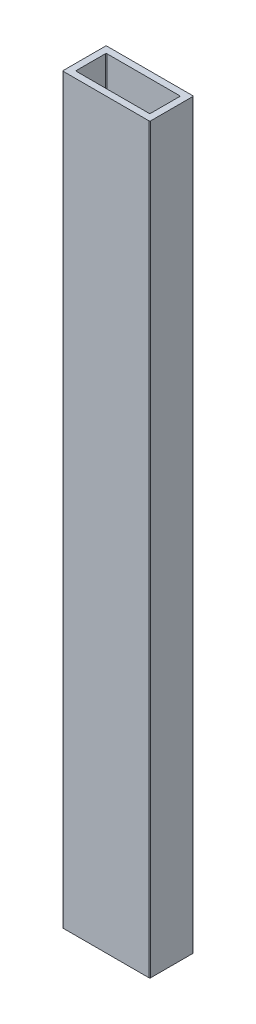
from build123d import *

# Parameters (mm, degrees)
SKETCH_1_W      = 20
SKETCH_1_H      = 10
SKETCH_1_W_2    = 17
SKETCH_1_H_2    = 7
EXTRUDE_1_DEPTH = 170
FILLET_1_R      = 0.2


with BuildPart() as part:
    # Эскиз1 → Бобышка-Вытянуть1 (new body)
    with BuildSketch(Plane(origin=(0, 0, 0), x_dir=(1, 0, 0), z_dir=(0, 1, 0))):
        Rectangle(SKETCH_1_W, SKETCH_1_H)
        Rectangle(SKETCH_1_W_2, SKETCH_1_H_2, mode=Mode.SUBTRACT)
    extrude(amount=EXTRUDE_1_DEPTH)

    # Скругление1
    fillet_1_edges = [part.edges().sort_by_distance(p)[0] for p in [
        (8.5, 85, 3.5),
        (8.5, 85, -3.5),
        (-8.5, 85, -3.5),
        (-8.5, 85, 3.5),
        (-10, 85, -5),
        (10, 85, -5),
        (10, 85, 5),
        (-10, 85, 5),
    ]]
    fillet(fillet_1_edges, radius=FILLET_1_R)


solid = part.part
